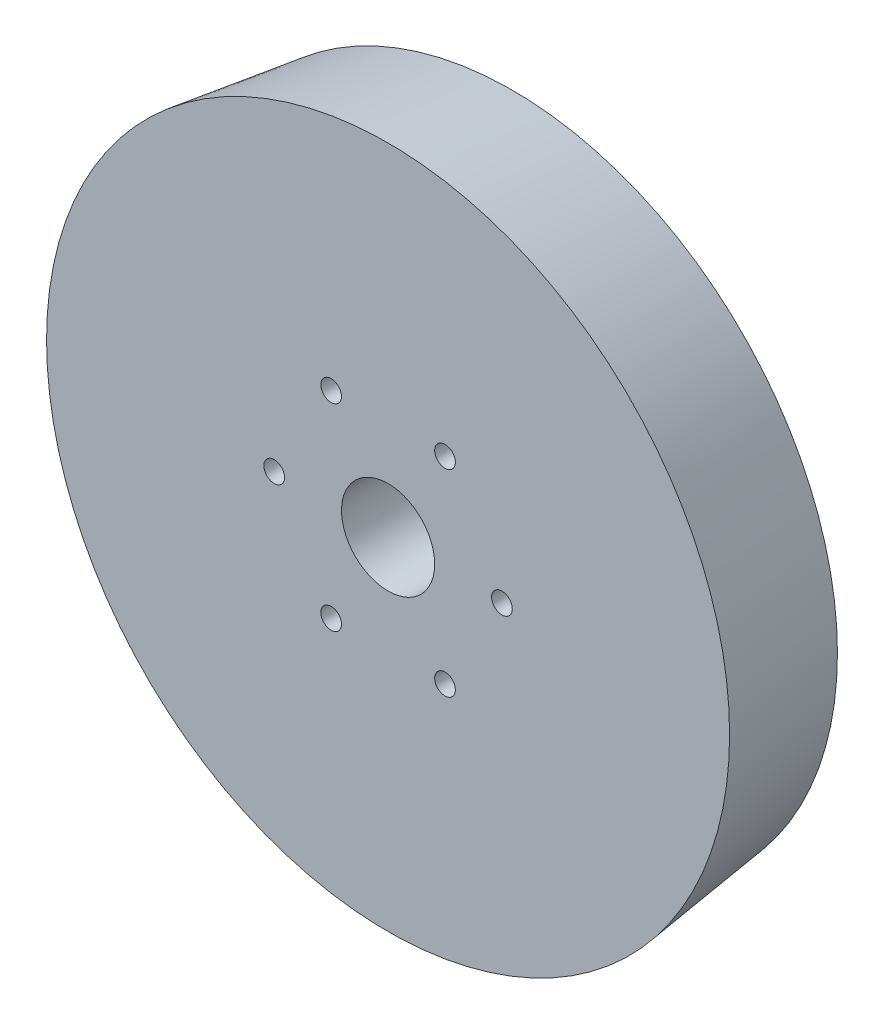
from build123d import *

# Parameters (mm, degrees)
SKETCH1_R           = 104.775
BOSS_EXTRUDE1_DEPTH = 38.1
BOSS_EXTRUDE1_DRAFT = -7.5
SKETCH2_R           = 14.2875
CUT_EXTRUDE1_DEPTH  = 153.9941543
SKETCH3_R           = 3.175
CUT_EXTRUDE2_DEPTH  = 38.1


with BuildPart() as part:
    # Sketch1 → Boss-Extrude1 (with draft: the straight prism first)
    with BuildSketch(Plane.XY):
        Circle(SKETCH1_R)
    extrude(amount=-BOSS_EXTRUDE1_DEPTH)
    # Boss-Extrude1: the draft: its side faces are tilted about the plane it starts from
    boss_extrude1_sides = [part.faces().sort_by_distance(p)[0] for p in [
        (-104.775, 0, -19.05),
    ]]
    draft(boss_extrude1_sides, Plane.XY, BOSS_EXTRUDE1_DRAFT)

    # Sketch2 → Cut-Extrude1 (cut, through all)
    with BuildSketch(Plane.XY):
        Circle(SKETCH2_R)
    extrude(amount=-CUT_EXTRUDE1_DEPTH, mode=Mode.SUBTRACT)

    # Sketch3 → Cut-Extrude2 (cut)
    with BuildSketch(Plane.XY):
        with Locations((34.925, 0)):
            Circle(SKETCH3_R)
        with Locations((17.4625, -30.245937227)):
            Circle(SKETCH3_R)
        with Locations((-17.4625, -30.245937227)):
            Circle(SKETCH3_R)
        with Locations((-34.925, 0)):
            Circle(SKETCH3_R)
        with Locations((-17.4625, 30.245937227)):
            Circle(SKETCH3_R)
        with Locations((17.4625, 30.245937227)):
            Circle(SKETCH3_R)
    extrude(amount=-CUT_EXTRUDE2_DEPTH, mode=Mode.SUBTRACT)


solid = part.part
